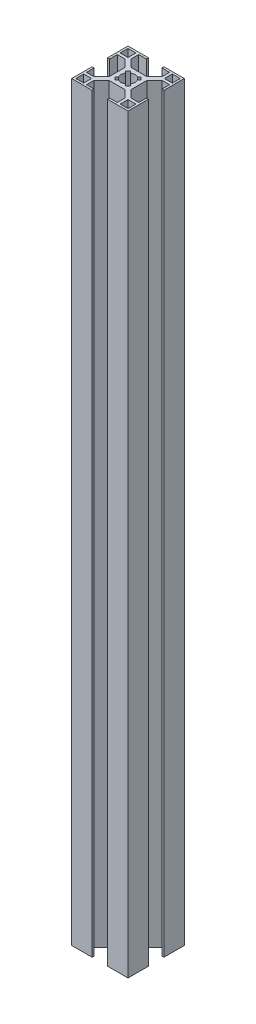
from build123d import *

# Parameters (mm, degrees)
CROQUIS2_W              = 4.2
CROQUIS2_H              = 4.2
SALIENTE_EXTRUIR1_DEPTH = 400


with BuildPart() as part:
    # Croquis2 → Saliente-Extruir1 (new body)
    with BuildSketch(Plane(origin=(0, 0, 0), x_dir=(1, 0, 0), z_dir=(0, 1, 0))):
        Polygon((-37.373217156, 24.271112291), (-26.498217156, 24.271112291), (-26.498217156, 23.171112291), (-30.573217156, 23.171112291), (-30.573217156, 19.168168566), (-26.586160881, 15.181112291), (-18.160273431, 15.181112291), (-14.173217156, 19.168168566), (-14.173217156, 23.171112291), (-18.248217156, 23.171112291), (-18.248217156, 24.271112291), (-7.373217156, 24.271112291), (-7.373217156, 13.396112291), (-8.473217156, 13.396112291), (-8.473217156, 17.471112291), (-12.476160881, 17.471112291), (-16.463217156, 13.484056016), (-16.463217156, 5.058168566), (-12.476160881, 1.071112291), (-8.473217156, 1.071112291), (-8.473217156, 5.146112291), (-7.373217156, 5.146112291), (-7.373217156, -5.728887709), (-18.248217156, -5.728887709), (-18.248217156, -4.628887709), (-14.173217156, -4.628887709), (-14.173217156, -0.625943984), (-18.160273431, 3.361112291), (-26.586160881, 3.361112291), (-30.573217156, -0.625943984), (-30.573217156, -4.628887709), (-26.498217156, -4.628887709), (-26.498217156, -5.728887709), (-37.373217156, -5.728887709), (-37.373217156, 5.146112291), (-36.273217156, 5.146112291), (-36.273217156, 1.071112291), (-32.270273431, 1.071112291), (-28.283217156, 5.058168566), (-28.283217156, 13.484056016), (-32.270273431, 17.471112291), (-36.273217156, 17.471112291), (-36.273217156, 13.396112291), (-37.373217156, 13.396112291), align=None)
        with Locations((-10.573217156, 21.071112291)):
            Rectangle(CROQUIS2_W, CROQUIS2_H, mode=Mode.SUBTRACT)
        with Locations((-34.173217156, -2.528887709)):
            Rectangle(CROQUIS2_W, CROQUIS2_H, mode=Mode.SUBTRACT)
        with Locations((-34.173217156, 21.071112291)):
            Rectangle(CROQUIS2_W, CROQUIS2_H, mode=Mode.SUBTRACT)
        with Locations((-10.573217156, -2.528887709)):
            Rectangle(CROQUIS2_W, CROQUIS2_H, mode=Mode.SUBTRACT)
        with BuildLine():
            Line((-19.165547938, 11.064567946), (-18.248217156, 11.981898728))
            Line((-18.248217156, 11.981898728), (-19.662430718, 13.396112291))
            Line((-19.662430718, 13.396112291), (-20.5797615, 12.478781509))
            ThreePointArc((-20.5797615, 12.478781509), (-22.373217156, 12.946112291), (-24.166672811, 12.478781509))
            Line((-24.166672811, 12.478781509), (-25.084003593, 13.396112291))
            Line((-25.084003593, 13.396112291), (-26.498217156, 11.981898728))
            Line((-26.498217156, 11.981898728), (-25.580886374, 11.064567946))
            ThreePointArc((-25.580886374, 11.064567946), (-26.048217156, 9.271112291), (-25.580886374, 7.477656635))
            Line((-25.580886374, 7.477656635), (-26.498217156, 6.560325853))
            Line((-26.498217156, 6.560325853), (-25.084003593, 5.146112291))
            Line((-25.084003593, 5.146112291), (-24.166672811, 6.063443073))
            ThreePointArc((-24.166672811, 6.063443073), (-22.373217156, 5.596112291), (-20.5797615, 6.063443073))
            Line((-20.5797615, 6.063443073), (-19.662430718, 5.146112291))
            Line((-19.662430718, 5.146112291), (-18.248217156, 6.560325853))
            Line((-18.248217156, 6.560325853), (-19.165547938, 7.477656635))
            ThreePointArc((-19.165547938, 7.477656635), (-18.698217156, 9.271112291), (-19.165547938, 11.064567946))
        make_face(mode=Mode.SUBTRACT)
    extrude(amount=SALIENTE_EXTRUIR1_DEPTH)


solid = part.part
